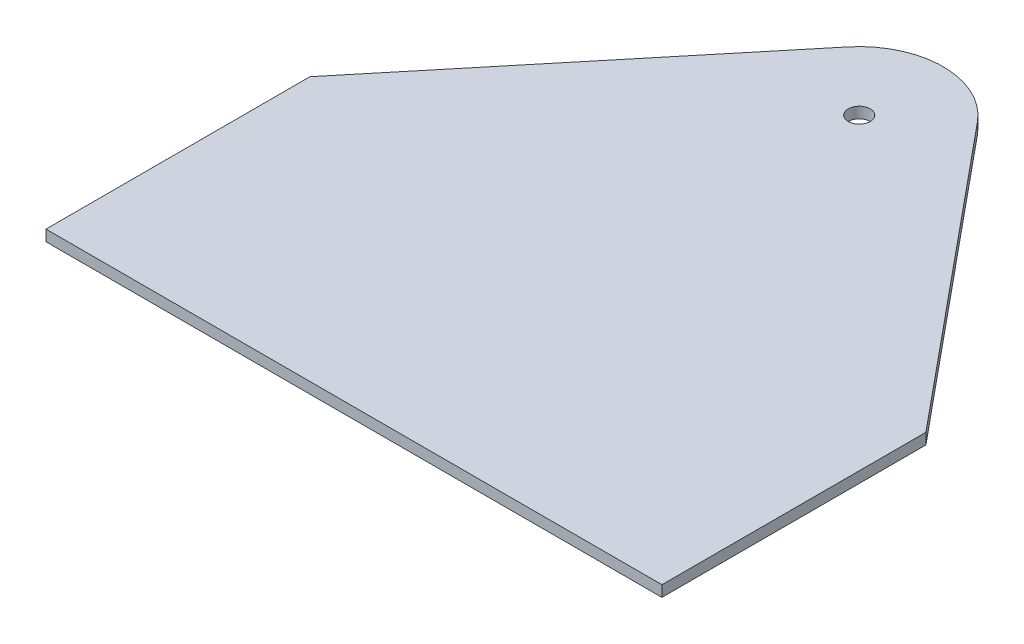
from build123d import *

# Parameters (mm, degrees)
SKETCH1_R           = 3.175
BOSS_EXTRUDE1_DEPTH = 3.175


with BuildPart() as part:
    # Sketch1 → Boss-Extrude1 (new body)
    with BuildSketch(Plane(origin=(0, 0, 0), x_dir=(1, 0, 0), z_dir=(0, 1, 0))):
        with BuildLine():
            Line((-88.9, 0), (88.9, 0))
            Line((88.9, 0), (88.9, 76.2))
            Line((88.9, 76.2), (18.702682169, 161.291999073))
            ThreePointArc((18.702682169, 161.291999073), (0, 170.108527998), (-18.702682169, 161.291999073))
            Line((-18.702682169, 161.291999073), (-88.9, 76.2))
            Line((-88.9, 76.2), (-88.9, 0))
        make_face()
        with Locations(Location((0, 145.863073453, 0), (0, 0, 270))):
            Circle(SKETCH1_R, mode=Mode.SUBTRACT)
    extrude(amount=BOSS_EXTRUDE1_DEPTH)


solid = part.part
